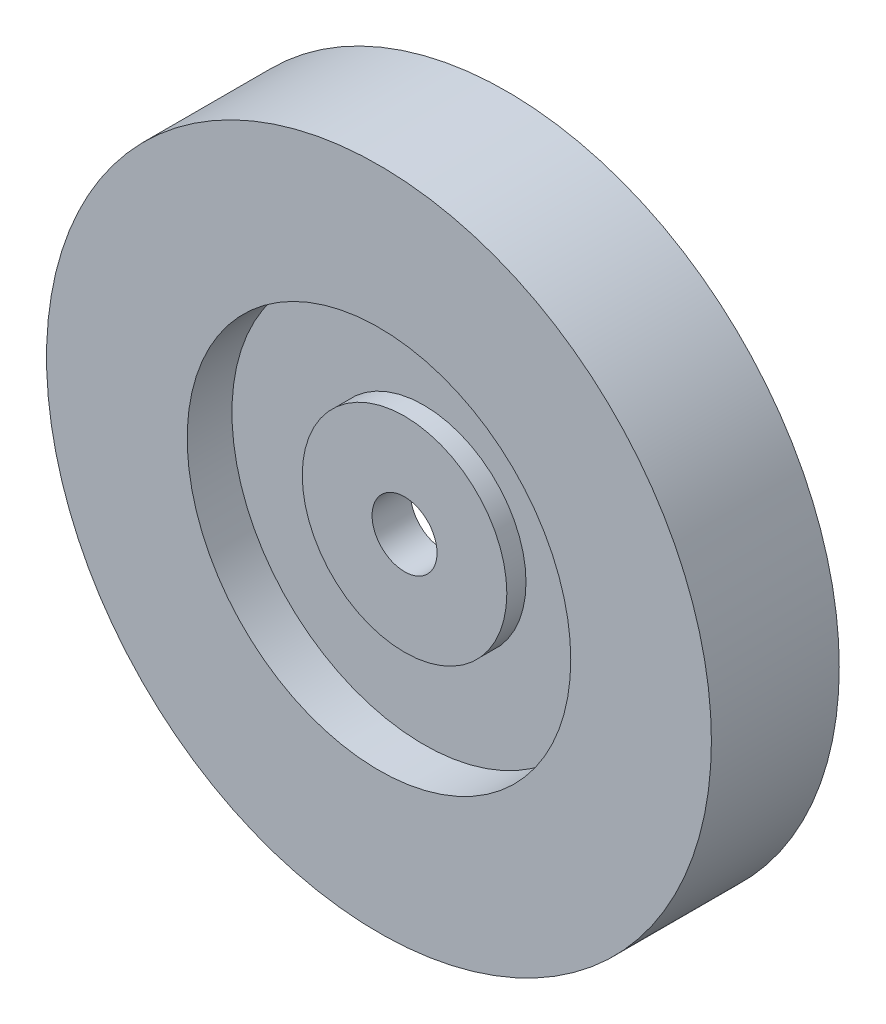
from build123d import *

# Parameters (mm, degrees)
CROQUIS1_R              = 260
CROQUIS1_R_2            = 150
SALIENTE_EXTRUIR1_DEPTH = 50
CROQUIS1_3_R            = 150
CROQUIS1_3_R_2          = 80
SALIENTE_EXTRUIR2_DEPTH = 15
CROQUIS1_4_R            = 80
CROQUIS1_4_R_2          = 25.4
SALIENTE_EXTRUIR3_DEPTH = 30


with BuildPart() as part:
    # Croquis1 → Saliente-Extruir1 (new, symmetric)
    with BuildSketch(Plane.XY):
        Circle(CROQUIS1_R)
        Circle(CROQUIS1_R_2, mode=Mode.SUBTRACT)
    extrude(amount=SALIENTE_EXTRUIR1_DEPTH, both=True)

    # Croquis1<3> → Saliente-Extruir2 (add, symmetric)
    with BuildSketch(Plane.XY):
        Circle(CROQUIS1_3_R)
        Circle(CROQUIS1_3_R_2, mode=Mode.SUBTRACT)
    extrude(amount=SALIENTE_EXTRUIR2_DEPTH, both=True)

    # Croquis1<4> → Saliente-Extruir3 (add)
    with BuildSketch(Plane.XY):
        Circle(CROQUIS1_4_R)
        Circle(CROQUIS1_4_R_2, mode=Mode.SUBTRACT)
    extrude(amount=SALIENTE_EXTRUIR3_DEPTH)


solid = part.part
